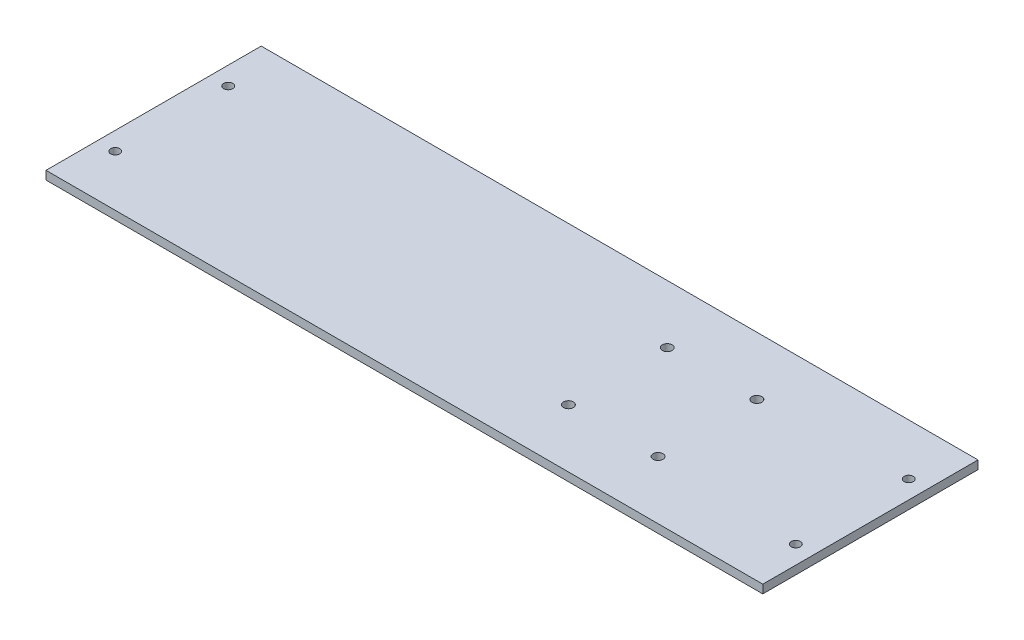
from build123d import *

# Parameters (mm, degrees)
SKETCH1_W           = 507.6
SKETCH1_H           = 152.4
BOSS_EXTRUDE1_DEPTH = 6
SKETCH2_R           = 3.25
CUT_EXTRUDE1_DEPTH  = 266.060144118
SKETCH3_R           = 3.5
CUT_EXTRUDE2_DEPTH  = 266.060144118


with BuildPart() as part:
    # Sketch1 → Boss-Extrude1 (new body)
    with BuildSketch(Plane(origin=(0, 0, 0), x_dir=(1, 0, 0), z_dir=(0, 1, 0))):
        Rectangle(SKETCH1_W, SKETCH1_H)
    extrude(amount=BOSS_EXTRUDE1_DEPTH)

    # Sketch2 → Cut-Extrude1 (cut, through all)
    with BuildSketch(Plane(origin=(0, 6, 0), x_dir=(1, 0, 0), z_dir=(0, 1, 0))):
        with Locations(Location((240.96, 40, 0), (0, 0, 270))):
            Circle(SKETCH2_R)
        with Locations(Location((240.96, -40, 0), (0, 0, 270))):
            Circle(SKETCH2_R)
        with Locations(Location((-240.96, -40, 0), (0, 0, 270))):
            Circle(SKETCH2_R)
        with Locations(Location((-240.96, 40, 0), (0, 0, 270))):
            Circle(SKETCH2_R)
    extrude(amount=-CUT_EXTRUDE1_DEPTH, mode=Mode.SUBTRACT)

    # Sketch3 → Cut-Extrude2 (cut, through all)
    with BuildSketch(Plane(origin=(0, 6, 0), x_dir=(1, 0, 0), z_dir=(0, 1, 0))):
        with Locations(Location((138.43, 35, 0), (0, 0, 270))):
            Circle(SKETCH3_R)
        with Locations(Location((74.93, 35, 0), (0, 0, 270))):
            Circle(SKETCH3_R)
        with Locations(Location((74.93, -35, 0), (0, 0, 270))):
            Circle(SKETCH3_R)
        with Locations(Location((138.43, -35, 0), (0, 0, 270))):
            Circle(SKETCH3_R)
    extrude(amount=-CUT_EXTRUDE2_DEPTH, mode=Mode.SUBTRACT)


solid = part.part
